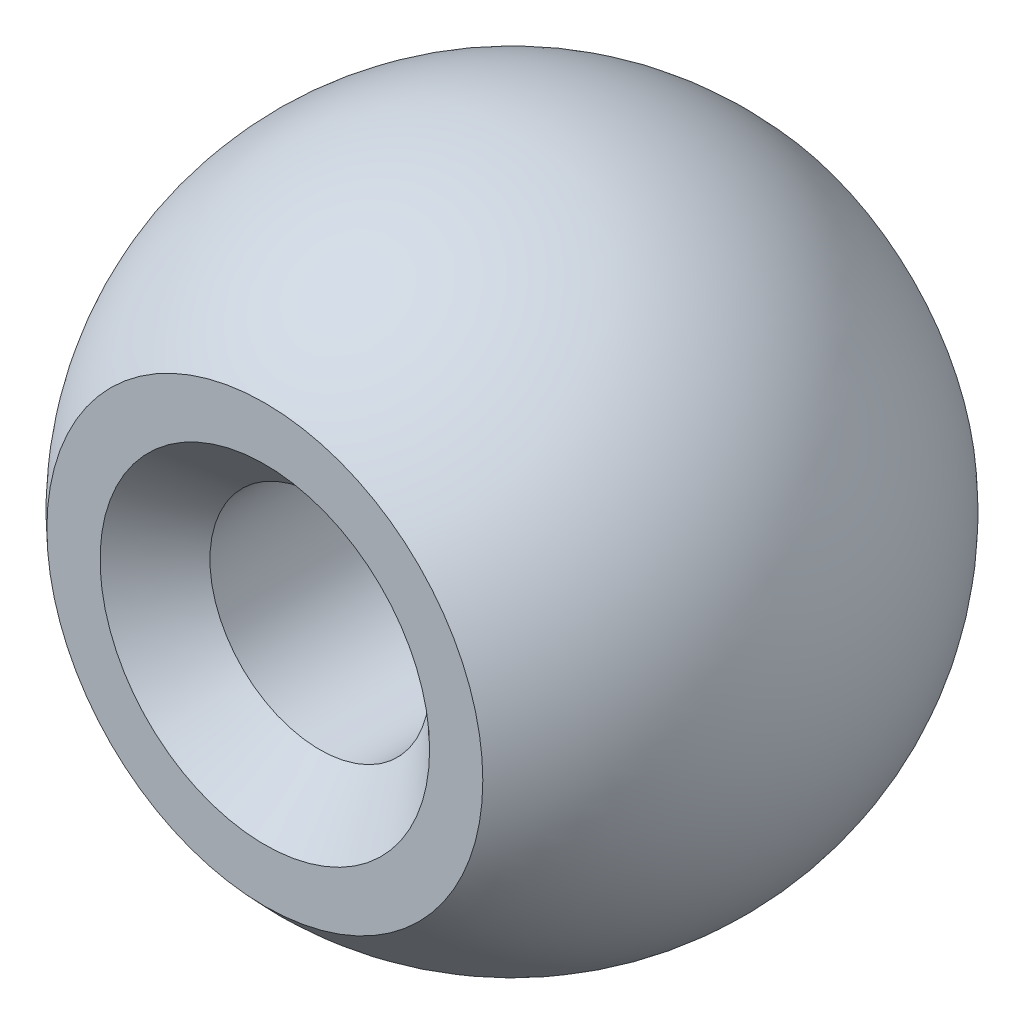
from build123d import *

# Parameters (mm, degrees)
SKETCH2_R          = 2
CUT_EXTRUDE1_DEPTH = 13.369316877
CHAMFER1_SIZE      = 1


with BuildPart() as part:
    # Sketch1 → Revolve1 (revolve)
    with BuildSketch(Plane(origin=(0, 0, 0), x_dir=(0, 0, -1), z_dir=(1, 0, 0))):
        with BuildLine():
            Line((-4.5, 3.968626967), (-4.5, 0))
            Line((-4.5, 0), (4.5, 0))
            Line((4.5, 0), (4.5, 3.968626967))
            ThreePointArc((4.5, 3.968626967), (0, 6), (-4.5, 3.968626967))
        make_face()
    revolve(axis=Axis((0, 0, 9.66298525), (0, 0, -1)))

    # Sketch2 → Cut-Extrude1 (cut, through all)
    with BuildSketch(Plane.XY.offset(4.5)):
        Circle(SKETCH2_R)
    extrude(amount=-CUT_EXTRUDE1_DEPTH, mode=Mode.SUBTRACT)

    # Chamfer1
    chamfer1_edges = [part.edges().sort_by_distance(p)[0] for p in [
        (-2, 0, 4.5),
    ]]
    chamfer(chamfer1_edges, length=CHAMFER1_SIZE)


solid = part.part
